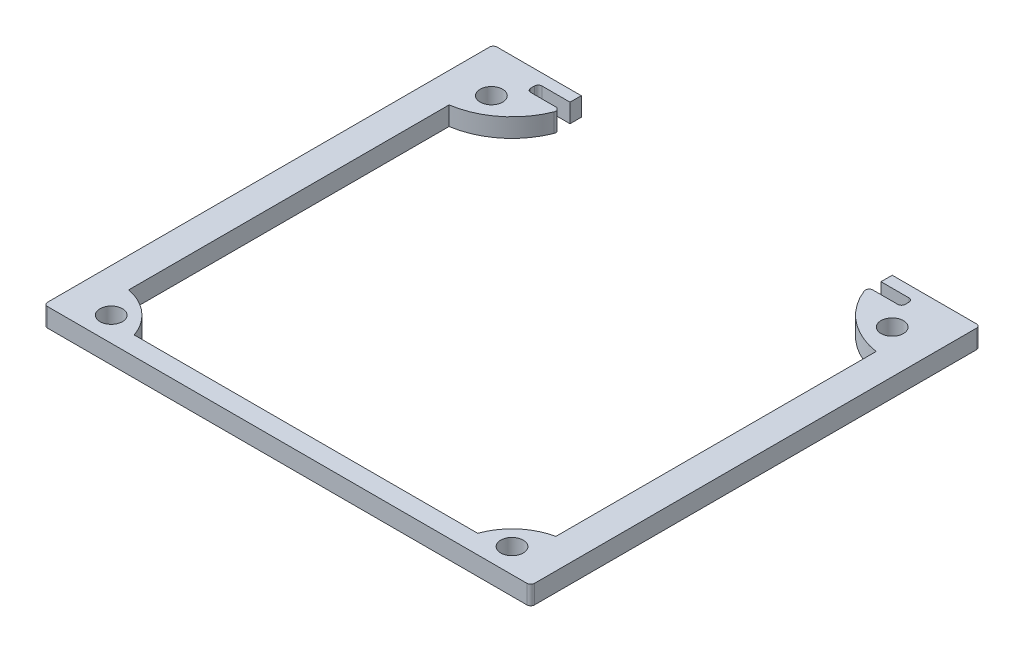
from build123d import *

# Parameters (mm, degrees)
SKETCH1_W           = 130
SKETCH1_H           = 120
SKETCH1_R           = 3
BOSS_EXTRUDE1_DEPTH = 5
SKETCH2_W           = 100
SKETCH2_H           = 3
CUT_EXTRUDE1_DEPTH  = 10
FILLET1_R           = 1
FILLET2_R           = 1
FILLET3_R           = 1
SKETCH3_W           = 83.01861615
SKETCH3_H           = 6.438048513
CUT_EXTRUDE2_DEPTH  = 10
SKETCH4_W           = 3
SKETCH4_H           = 92.008130055
BOSS_EXTRUDE2_DEPTH = 5
FILLET4_R           = 1


with BuildPart() as part:
    # Sketch1 → Boss-Extrude1 (new body)
    with BuildSketch(Plane(origin=(0, 0, 0), x_dir=(1, 0, 0), z_dir=(0, 1, 0))):
        with Locations((60, 60)):
            Rectangle(SKETCH1_W, SKETCH1_H)
        with Locations(Location((6.5, 6.5, 0), (0, 0, 270))):
            Circle(SKETCH1_R, mode=Mode.SUBTRACT)
        with Locations(Location((113.5, 6.5, 0), (0, 0, 270))):
            Circle(SKETCH1_R, mode=Mode.SUBTRACT)
        with Locations(Location((6.5, 108, 0), (0, 0, 270))):
            Circle(SKETCH1_R, mode=Mode.SUBTRACT)
        with Locations(Location((113.5, 108, 0), (0, 0, 270))):
            Circle(SKETCH1_R, mode=Mode.SUBTRACT)
        with BuildLine():
            Line((0, 100), (0, 15))
            ThreePointArc((0, 15), (8.660254038, 12.247448714), (14.142135624, 5))
            Line((14.142135624, 5), (15, 5))
            Line((15, 5), (105, 5))
            Line((105, 5), (105.857864376, 5))
            ThreePointArc((105.857864376, 5), (111.339745962, 12.247448714), (120, 15))
            Line((120, 15), (120, 100))
            ThreePointArc((120, 100), (107.752551286, 104.188611699), (100.635083269, 115))
            Line((100.635083269, 115), (100, 115))
            Line((100, 115), (20, 115))
            Line((20, 115), (19.364916731, 115))
            ThreePointArc((19.364916731, 115), (12.247448714, 104.188611699), (0, 100))
        make_face(mode=Mode.SUBTRACT)
    extrude(amount=BOSS_EXTRUDE1_DEPTH)

    # Sketch2 → Cut-Extrude1 (cut)
    with BuildSketch(Plane(origin=(0, 5, 0), x_dir=(1, 0, 0), z_dir=(0, 1, 0))):
        with Locations((60, 115.5)):
            Rectangle(SKETCH2_W, SKETCH2_H)
    extrude(amount=-CUT_EXTRUDE1_DEPTH, mode=Mode.SUBTRACT)

    # Fillet1
    fillet1_edges = [part.edges().sort_by_distance(p)[0] for p in [
        (10, 2.5, -114),
        (10, 2.5, -117),
        (110, 2.5, -117),
        (110, 2.5, -114),
    ]]
    fillet(fillet1_edges, radius=FILLET1_R)

    # Fillet2
    fillet2_edges = [part.edges().sort_by_distance(p)[0] for p in [
        (19.078784028, 2.5, -114),
    ]]
    fillet(fillet2_edges, radius=FILLET2_R)

    # Fillet3
    fillet3_edges = [part.edges().sort_by_distance(p)[0] for p in [
        (100.921215972, 2.5, -114),
    ]]
    fillet(fillet3_edges, radius=FILLET3_R)

    # Sketch3 → Cut-Extrude2 (cut)
    with BuildSketch(Plane(origin=(0, 5, 0), x_dir=(1, 0, 0), z_dir=(0, 1, 0))):
        with Locations((60, 116.780975744)):
            Rectangle(SKETCH3_W, SKETCH3_H)
    extrude(amount=-CUT_EXTRUDE2_DEPTH, mode=Mode.SUBTRACT)

    # Sketch4 → Boss-Extrude2 (add)
    with BuildSketch(Plane(origin=(0, 5, 0), x_dir=(1, 0, 0), z_dir=(0, 1, 0))):
        with Locations((118.5, 57.563435723)):
            Rectangle(SKETCH4_W, SKETCH4_H)
        with Locations((1.479834165, 57.563435723)):
            Rectangle(SKETCH4_W, SKETCH4_H)
    extrude(amount=-BOSS_EXTRUDE2_DEPTH)

    # Fillet4
    fillet4_edges = [part.edges().sort_by_distance(p)[0] for p in [
        (125, 2.5, -120),
        (125, 2.5, 0),
        (-5, 2.5, 0),
        (-5, 2.5, -120),
    ]]
    fillet(fillet4_edges, radius=FILLET4_R)


solid = part.part
